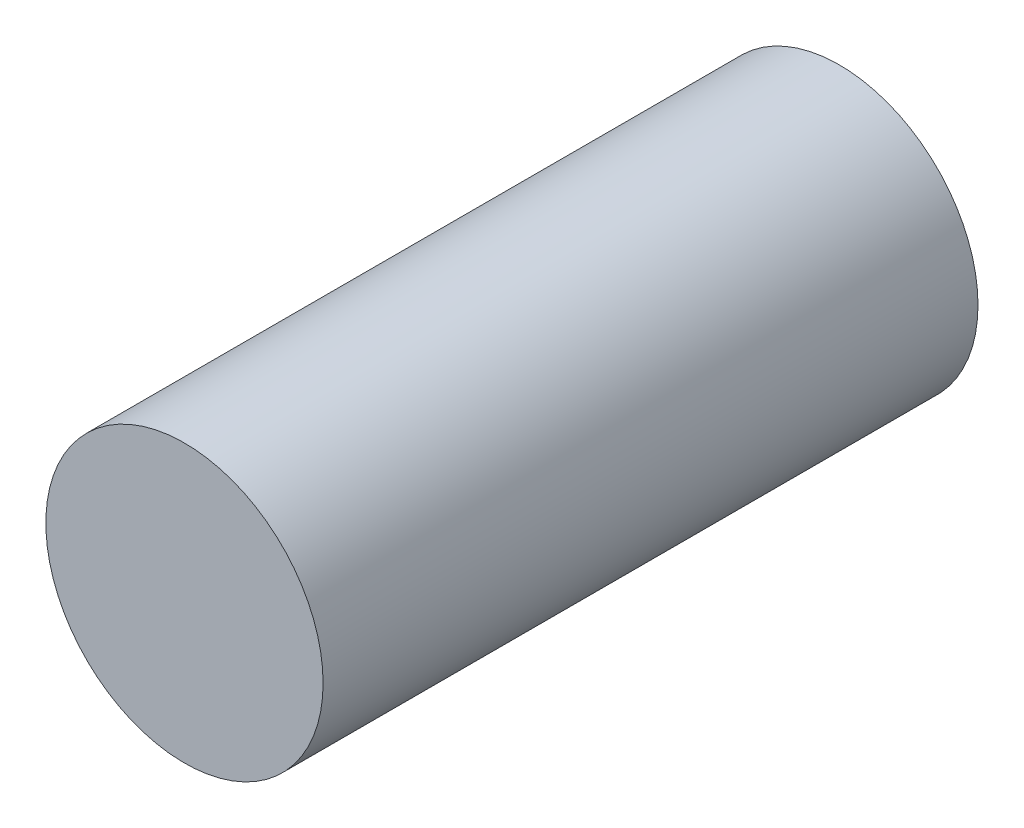
from build123d import *

# Parameters (mm, degrees)
SKETCH1_R           = 12.7
BOSS_EXTRUDE1_DEPTH = 60


with BuildPart() as part:
    # Sketch1 → Boss-Extrude1 (new body)
    with BuildSketch(Plane.XY):
        Circle(SKETCH1_R)
    extrude(amount=BOSS_EXTRUDE1_DEPTH)


solid = part.part
